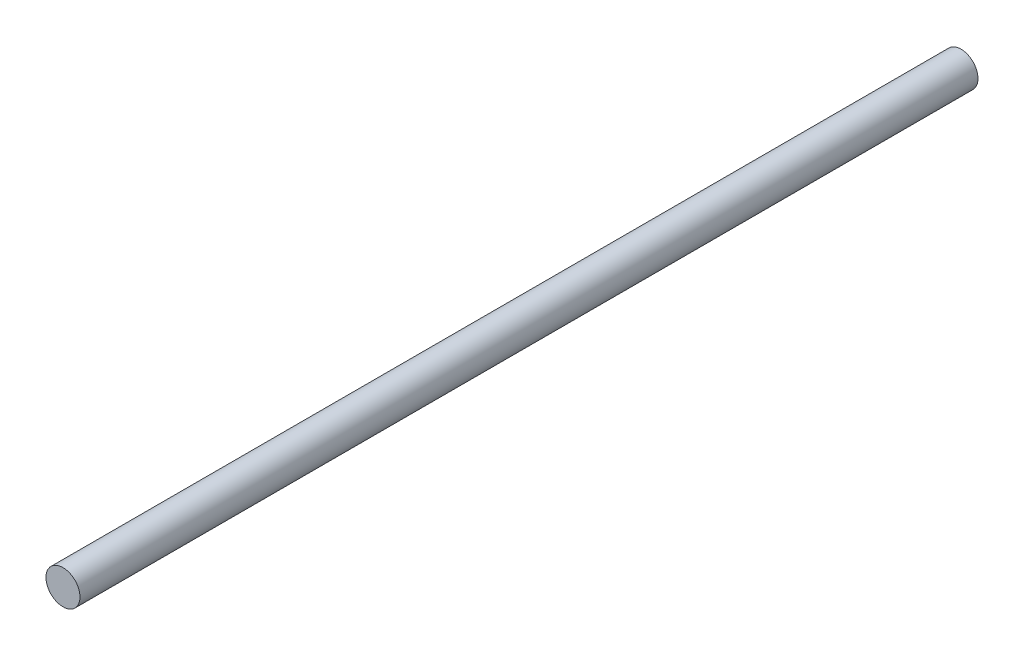
from build123d import *

# Parameters (mm, degrees)
SKETCH2_R           = 5
BOSS_EXTRUDE1_DEPTH = 264


with BuildPart() as part:
    # Sketch2 → Boss-Extrude1 (new body)
    with BuildSketch(Plane.XY):
        Circle(SKETCH2_R)
    extrude(amount=BOSS_EXTRUDE1_DEPTH)


solid = part.part
